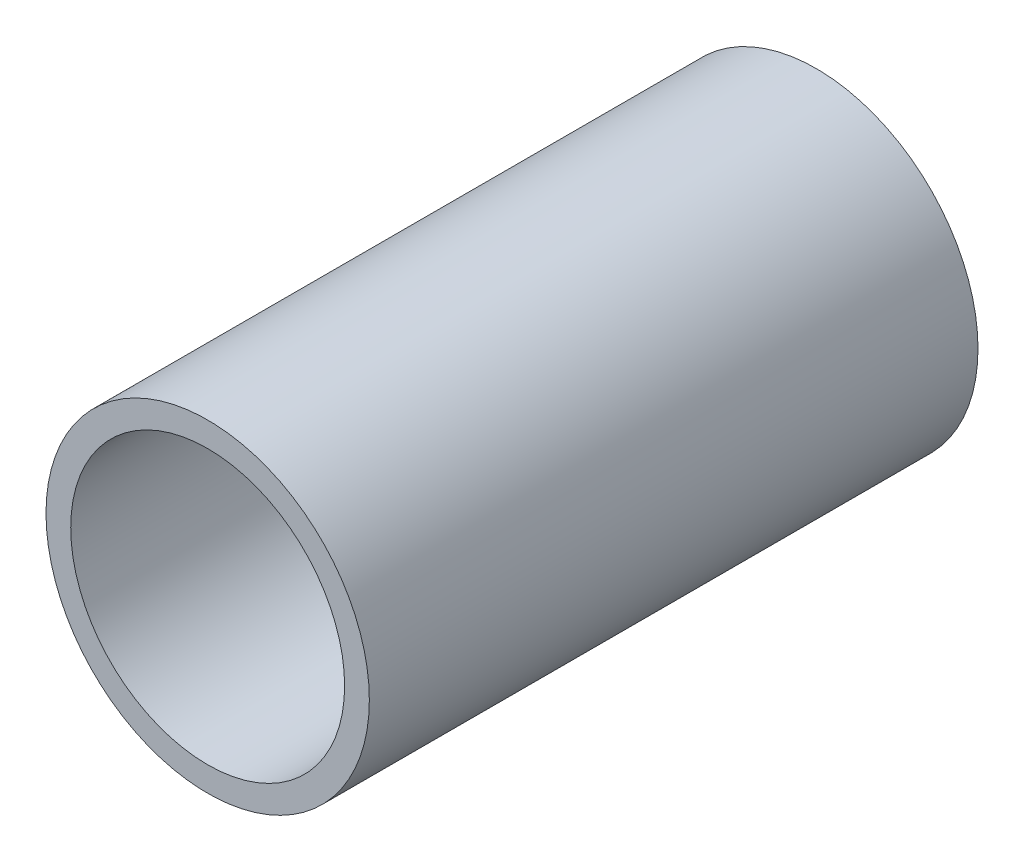
from build123d import *

# Parameters (mm, degrees)
BOSS_EXTRUDE1_DEPTH      = 2
BOSS_EXTRUDE1_DEPTH_BACK = 30
SKETCH1_R                = 8.5
SKETCH1_R_2              = 7.2


with BuildPart() as part:
    # Sketch1 → Boss-Extrude1 (new, two sides: drawn at the far end of the back side and taken through both)
    with BuildSketch(Plane.XY.offset(32.591649273).offset(-BOSS_EXTRUDE1_DEPTH_BACK)):
        with Locations((10.160617153, 18.12022925)):
            Circle(SKETCH1_R)
        with Locations((10.160617153, 18.12022925)):
            Circle(SKETCH1_R_2, mode=Mode.SUBTRACT)
    extrude(amount=BOSS_EXTRUDE1_DEPTH + BOSS_EXTRUDE1_DEPTH_BACK)


solid = part.part
